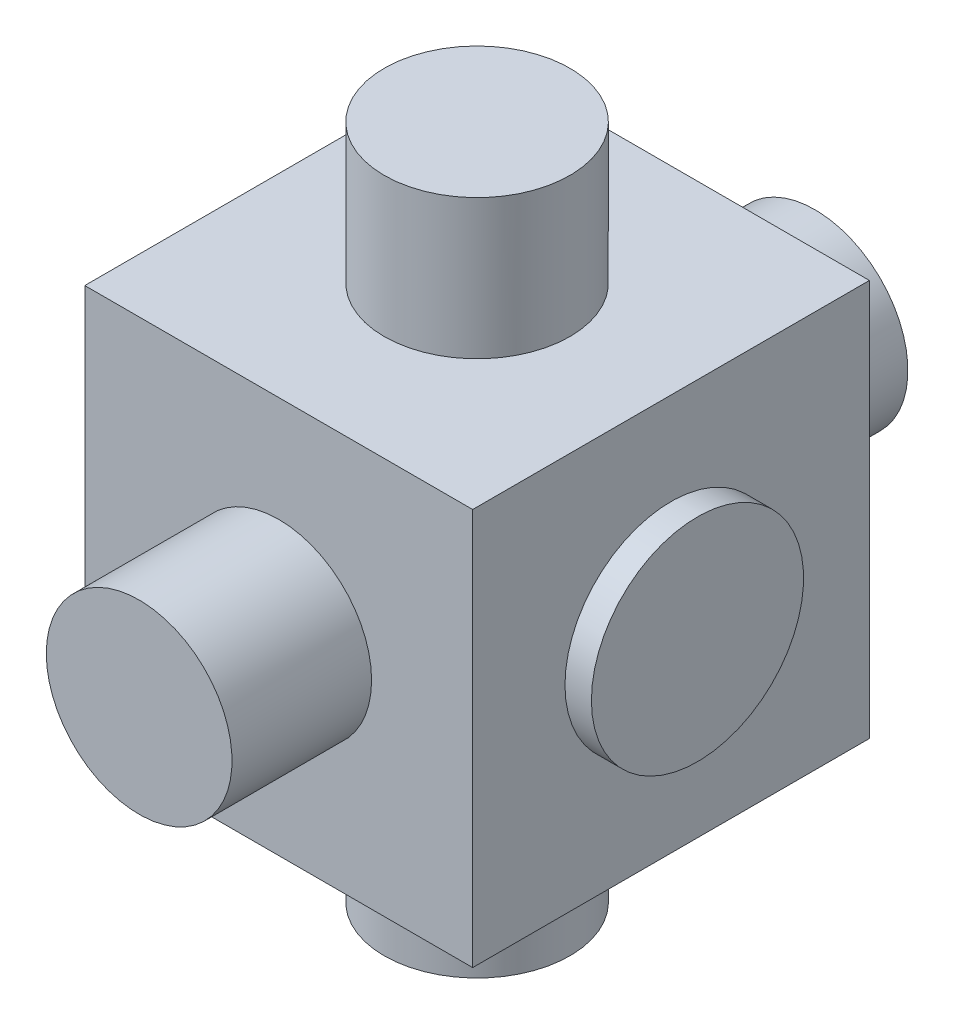
from build123d import *

# Parameters (mm, degrees)
BOSS_EXTRUDE1_DEPTH      = 6.75
BOSS_EXTRUDE1_DEPTH_BACK = 6.75
SKETCH1_W                = 13.2
SKETCH1_H                = 13.5
SKETCH2_W                = 3.16
SKETCH2_H                = 23
SKETCH3_W                = 3.16
SKETCH3_H                = 23
SKETCH4_W                = 15
SKETCH4_H                = 3.61


with BuildPart() as part:
    # Sketch1 → Boss-Extrude1 (new, two sides: drawn at the far end of the back side and taken through both)
    with BuildSketch(Plane.XY.offset(-BOSS_EXTRUDE1_DEPTH_BACK)):
        with Locations((26, 0)):
            Rectangle(SKETCH1_W, SKETCH1_H)
    extrude(amount=BOSS_EXTRUDE1_DEPTH + BOSS_EXTRUDE1_DEPTH_BACK)

    # Sketch2 → Revolve1 (revolve)
    with BuildSketch(Plane.XY):
        with Locations((27.58, 0)):
            Rectangle(SKETCH2_W, SKETCH2_H)
    revolve(axis=Axis((26, -11.5, 0), (0, 1, 0)))

    # Sketch3 → Revolve2 (revolve)
    with BuildSketch(Plane(origin=(0, 0, 0), x_dir=(1, 0, 0), z_dir=(0, 1, 0))):
        with Locations((27.58, 0)):
            Rectangle(SKETCH3_W, SKETCH3_H)
    revolve(axis=Axis((26, 0, 11.5), (0, 0, -1)))

    # Sketch4 → Revolve3 (revolve)
    with BuildSketch(Plane.XY):
        with Locations((26, 1.805)):
            Rectangle(SKETCH4_W, SKETCH4_H)
    revolve(axis=Axis((33.5, 0, 0), (-1, 0, 0)))


solid = part.part
